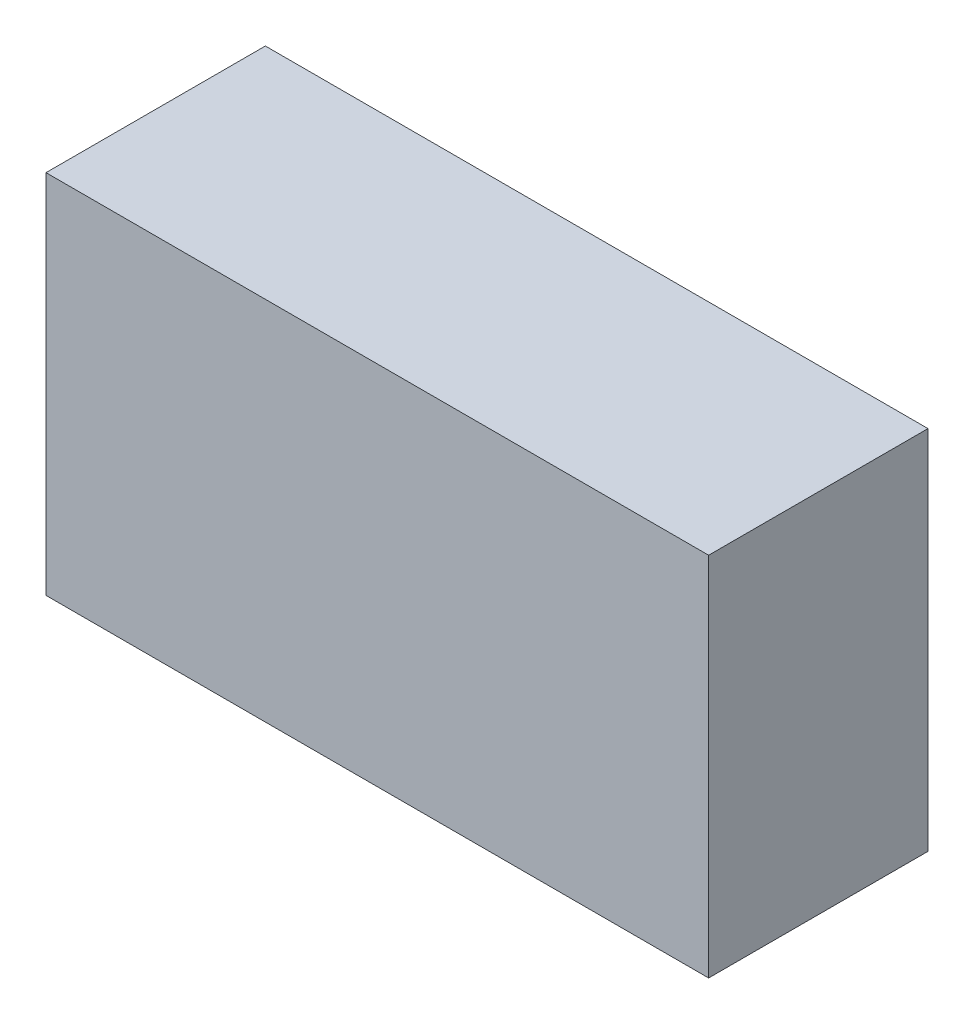
from build123d import *

# Parameters (mm, degrees)
SKETCH1_W                 = 21.90130149
SKETCH1_H                 = 12.101430126
BOSS_EXTRUDE1_DEPTH       = 7.25
SHELL1_T                  = -0.5
SHELL1_THICKNESS_2_FACE_W = 20.90130149
SHELL1_THICKNESS_2_FACE_H = 11.101430126
SHELL1_THICKNESS_2_DEPTH  = 0.3


with BuildPart() as part:
    # Sketch1 → Boss-Extrude1 (new body)
    with BuildSketch(Plane.XY):
        with Locations((-68.086150745, 71.520715063)):
            Rectangle(SKETCH1_W, SKETCH1_H)
    extrude(amount=BOSS_EXTRUDE1_DEPTH)

    # Shell1
    shell1_openings = [part.faces().sort_by_distance(p)[0] for p in [
        (-68.086150745, 71.520715063, 0),
    ]]
    offset(amount=SHELL1_T, openings=shell1_openings, kind=Kind.INTERSECTION)

    # Shell1 thickness 2 face (on inner face of the shell) → Shell1 thickness 2 (cut)
    with BuildSketch(Plane(origin=(-68.086150745, 71.520715063, 6.75), x_dir=(1, 0, 0), z_dir=(0, 0, 1))):
        Rectangle(SHELL1_THICKNESS_2_FACE_W, SHELL1_THICKNESS_2_FACE_H)
    extrude(amount=SHELL1_THICKNESS_2_DEPTH, mode=Mode.SUBTRACT)


solid = part.part
